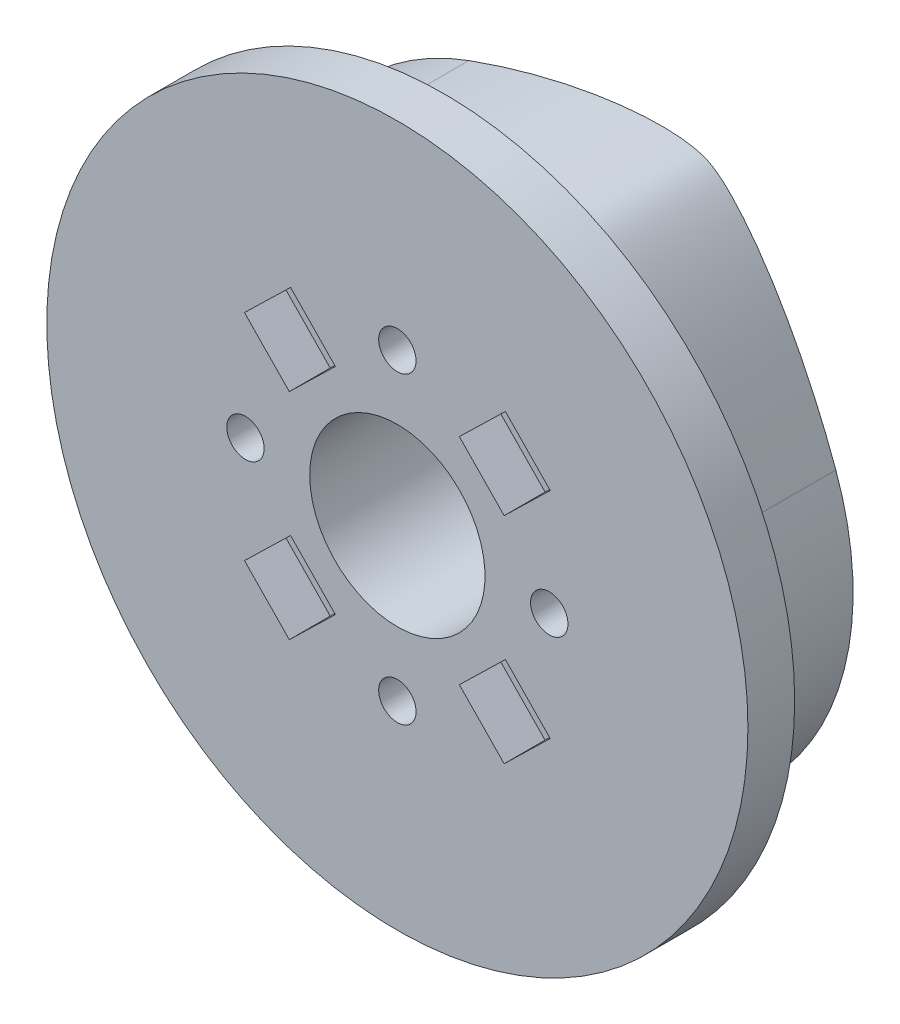
from build123d import *

# Parameters (mm, degrees)
SKETCH1_R           = 21
SKETCH1_R_2         = 2.85
SKETCH1_R_3         = 1.6
BOSS_EXTRUDE1_DEPTH = 10.5
SKETCH2_R           = 24.5
SKETCH2_R_2         = 21
BOSS_EXTRUDE3_DEPTH = 10.5
SKETCH4_R           = 30
SKETCH4_R_2         = 1.6
BOSS_EXTRUDE5_DEPTH = 4
BOSS_EXTRUDE4_START = 0.5
SKETCH3_R           = 21
SKETCH3_R_2         = 1.6
BOSS_EXTRUDE4_DEPTH = 0.5
SKETCH6_W           = 5.5
SKETCH6_H           = 5.5
CUT_EXTRUDE2_DEPTH  = 3.5
SKETCH7_R           = 1.6
CUT_EXTRUDE3_DEPTH  = 46.000000133
SKETCH7_3_R         = 1.6
CUT_EXTRUDE4_DEPTH  = 3.5
SKETCH8_R           = 7.5
CUT_EXTRUDE5_DEPTH  = 46.000000133


with BuildPart() as part:
    # Sketch1 → Boss-Extrude1 (new body)
    # profile 1 of 5: a face of its own
    with BuildSketch(Plane(origin=(0, 0, 0), x_dir=(0, 1, 0), z_dir=(0, 0, 1))):
        with Locations(Location((0, 0, 0), (0, 0, 90))):
            Circle(SKETCH1_R)
        with Locations((-13, 0)):
            Circle(SKETCH1_R_2, mode=Mode.SUBTRACT)
        with Locations((0, -13)):
            Circle(SKETCH1_R_2, mode=Mode.SUBTRACT)
        with Locations((13, 0)):
            Circle(SKETCH1_R_2, mode=Mode.SUBTRACT)
        with Locations((0, 13)):
            Circle(SKETCH1_R_2, mode=Mode.SUBTRACT)
    # profile 2 of 5: a face of its own
    with BuildSketch(Plane(origin=(0, 0, 0), x_dir=(0, 1, 0), z_dir=(0, 0, 1))):
        with Locations((-13, 0)):
            Circle(SKETCH1_R_2)
        with Locations(Location((-13, 0, 0), (0, 0, 90))):
            Circle(SKETCH1_R_3, mode=Mode.SUBTRACT)
    # profile 3 of 5: a face of its own
    with BuildSketch(Plane(origin=(0, 0, 0), x_dir=(0, 1, 0), z_dir=(0, 0, 1))):
        with Locations((0, 13)):
            Circle(SKETCH1_R_2)
        with Locations(Location((0, 13, 0), (0, 0, 90))):
            Circle(SKETCH1_R_3, mode=Mode.SUBTRACT)
    # profile 4 of 5: a face of its own
    with BuildSketch(Plane(origin=(0, 0, 0), x_dir=(0, 1, 0), z_dir=(0, 0, 1))):
        with Locations((13, 0)):
            Circle(SKETCH1_R_2)
        with Locations(Location((13, 0, 0), (0, 0, 90))):
            Circle(SKETCH1_R_3, mode=Mode.SUBTRACT)
    # profile 5 of 5: a face of its own
    with BuildSketch(Plane(origin=(0, 0, 0), x_dir=(0, 1, 0), z_dir=(0, 0, 1))):
        with Locations((0, -13)):
            Circle(SKETCH1_R_2)
        with Locations(Location((0, -13, 0), (0, 0, 90))):
            Circle(SKETCH1_R_3, mode=Mode.SUBTRACT)
    extrude(amount=BOSS_EXTRUDE1_DEPTH)

    # Sketch2 → Boss-Extrude3 (add)
    # profile 1 of 2: a face of its own
    with BuildSketch(Plane(origin=(0, 0, 0), x_dir=(1, 0, 0), z_dir=(0, 0, -1))):
        Circle(SKETCH2_R)
        Circle(SKETCH2_R_2, mode=Mode.SUBTRACT)
    # profile 2 of 2: a face of its own
    with BuildSketch(Plane(origin=(0, 0, 0), x_dir=(1, 0, 0), z_dir=(0, 0, -1))):
        with BuildLine():
            ThreePointArc((23.022469209, -8.379493511), (10.354147413, -22.204540782), (-8.379493511, -23.022469209))
            add(Edge.make_bspline(
                [(-8.379493511, -23.022469209), (0.077740076, -26.100650499), (9.399453165, -27.107478442), (14.723681196, -24.624750138), (19.944287919, -16.836727099), (23.022469209, -8.379493511)],
                knots=[0, 0, 0, 0, 0.45, 0.55, 1, 1, 1, 1], degree=3))
        make_face()
    extrude(amount=-BOSS_EXTRUDE3_DEPTH)

    # Sketch4 → Boss-Extrude5 (add)
    with BuildSketch(Plane.XY.offset(10.5)):
        Circle(SKETCH4_R)
        with Locations(Location((-13, 0, 0), (0, 0, 180))):
            Circle(SKETCH4_R_2, mode=Mode.SUBTRACT)
        with Locations(Location((0, 13, 0), (0, 0, 180))):
            Circle(SKETCH4_R_2, mode=Mode.SUBTRACT)
        with Locations(Location((13, 0, 0), (0, 0, 180))):
            Circle(SKETCH4_R_2, mode=Mode.SUBTRACT)
        with Locations(Location((0, -13, 0), (0, 0, 180))):
            Circle(SKETCH4_R_2, mode=Mode.SUBTRACT)
    extrude(amount=BOSS_EXTRUDE5_DEPTH)

    # Sketch3 → Boss-Extrude4 (add)
    with BuildSketch(Plane(origin=(0, 0, 0), x_dir=(1, 0, 0), z_dir=(0, 0, -1)).offset(BOSS_EXTRUDE4_START)):
        with Locations(Location((0, 0, 0), (0, 0, 180))):
            Circle(SKETCH3_R)
        with Locations(Location((-13, 0, 0), (0, 0, 180))):
            Circle(SKETCH3_R_2, mode=Mode.SUBTRACT)
        with Locations(Location((0, 13, 0), (0, 0, 180))):
            Circle(SKETCH3_R_2, mode=Mode.SUBTRACT)
        with Locations(Location((13, 0, 0), (0, 0, 180))):
            Circle(SKETCH3_R_2, mode=Mode.SUBTRACT)
        with Locations(Location((0, -13, 0), (0, 0, 180))):
            Circle(SKETCH3_R_2, mode=Mode.SUBTRACT)
    extrude(amount=-BOSS_EXTRUDE4_DEPTH)

    # Sketch6 → Cut-Extrude2 (cut)
    with BuildSketch(Plane(origin=(0, 0, -0.5), x_dir=(1, 0, 0), z_dir=(0, 0, -1))):
        with Locations((13, 0)):
            Rectangle(SKETCH6_W, SKETCH6_H)
        with Locations((0, 13)):
            Rectangle(SKETCH6_W, SKETCH6_H)
        with Locations((0, -13)):
            Rectangle(SKETCH6_W, SKETCH6_H)
        with Locations((-13, 0)):
            Rectangle(SKETCH6_W, SKETCH6_H)
    extrude(amount=-CUT_EXTRUDE2_DEPTH, mode=Mode.SUBTRACT)

    # Sketch7 → Cut-Extrude3 (cut, through all)
    with BuildSketch(Plane.XY.offset(14.5)):
        with Locations((9.192388155, 9.192388155)):
            Circle(SKETCH7_R)
        with Locations((9.192388155, -9.192388155)):
            Circle(SKETCH7_R)
        with Locations((-9.192388155, -9.192388155)):
            Circle(SKETCH7_R)
        with Locations((-9.192388155, 9.192388155)):
            Circle(SKETCH7_R)
    extrude(amount=-CUT_EXTRUDE3_DEPTH, mode=Mode.SUBTRACT)

    # Sketch7<3> → Cut-Extrude4 (cut)
    # profile 1 of 4: a face of its own
    with BuildSketch(Plane.XY.offset(14.5)):
        Polygon((9.245595054, 13.080678059), (5.304110209, 9.246461763), (9.139181257, 5.304098252), (13.080666102, 9.138314547), align=None)
        with Locations((9.192388155, 9.192388155)):
            Circle(SKETCH7_3_R, mode=Mode.SUBTRACT)
    # profile 2 of 4: a face of its own
    with BuildSketch(Plane.XY.offset(14.5)):
        Polygon((9.138314547, -13.080666102), (5.304098252, -9.139181257), (9.246461763, -5.304110209), (13.080678059, -9.245595054), align=None)
        with Locations((9.192388155, -9.192388155)):
            Circle(SKETCH7_3_R, mode=Mode.SUBTRACT)
    # profile 3 of 4: a face of its own
    with BuildSketch(Plane.XY.offset(14.5)):
        Polygon((-13.080666102, -9.138314547), (-9.139181257, -5.304098252), (-5.304110209, -9.246461763), (-9.245595054, -13.080678059), align=None)
        with Locations((-9.192388155, -9.192388155)):
            Circle(SKETCH7_3_R, mode=Mode.SUBTRACT)
    # profile 4 of 4: a face of its own
    with BuildSketch(Plane.XY.offset(14.5)):
        Polygon((-9.138314547, 13.080666102), (-5.304098252, 9.139181257), (-9.246461763, 5.304110209), (-13.080678059, 9.245595054), align=None)
        with Locations((-9.192388155, 9.192388155)):
            Circle(SKETCH7_3_R, mode=Mode.SUBTRACT)
    extrude(amount=-CUT_EXTRUDE4_DEPTH, mode=Mode.SUBTRACT)

    # Sketch8 → Cut-Extrude5 (cut, through all)
    with BuildSketch(Plane(origin=(0, 0, -0.5), x_dir=(1, 0, 0), z_dir=(0, 0, -1))):
        with Locations(Location((0, 0, 0), (0, 0, 180))):
            Circle(SKETCH8_R)
    extrude(amount=-CUT_EXTRUDE5_DEPTH, mode=Mode.SUBTRACT)


solid = part.part
